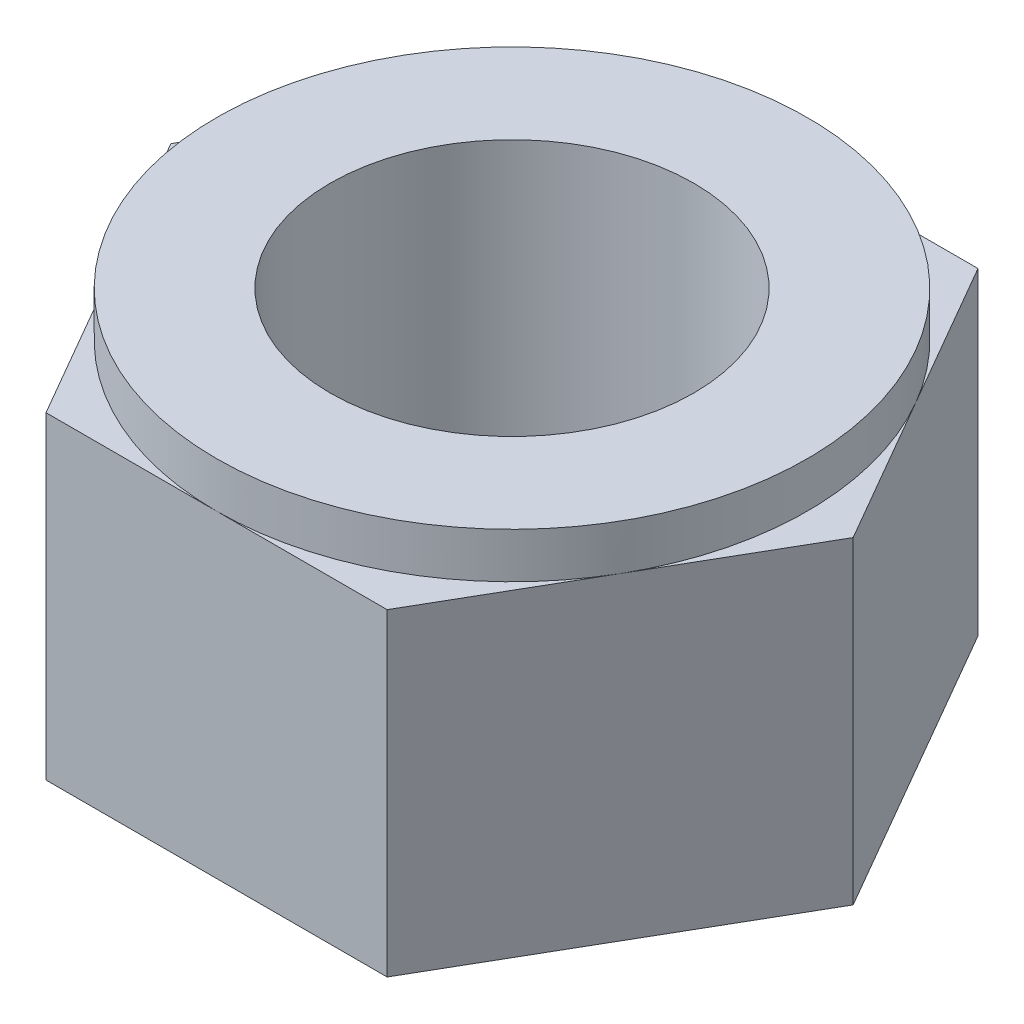
from build123d import *

# Parameters (mm, degrees)
EXTRUDE_1_DEPTH     = 7
SKETCH_2_R          = 6.5
EXTRUDE_2_DEPTH     = 1
SKETCH_3_R          = 4
CUT_EXTRUDE_1_DEPTH = 13.750816967


with BuildPart() as part:
    # 草图1 → 凸台-拉伸1 (new body)
    with BuildSketch(Plane(origin=(0, 0, 0), x_dir=(1, 0, 0), z_dir=(0, 1, 0))):
        Polygon((7.505553499, 0), (3.75277675, 6.5), (-3.75277675, 6.5), (-7.505553499, 0), (-3.75277675, -6.5), (3.75277675, -6.5), align=None)
    extrude(amount=EXTRUDE_1_DEPTH)

    # 草图2 → 凸台-拉伸2 (add)
    with BuildSketch(Plane(origin=(0, 7, 0), x_dir=(1, 0, 0), z_dir=(0, 1, 0))):
        Circle(SKETCH_2_R)
    extrude(amount=EXTRUDE_2_DEPTH)

    # 草图3 → 切除-拉伸1 (cut, through all)
    with BuildSketch(Plane.XZ):
        Circle(SKETCH_3_R)
    extrude(amount=-CUT_EXTRUDE_1_DEPTH, mode=Mode.SUBTRACT)


solid = part.part
